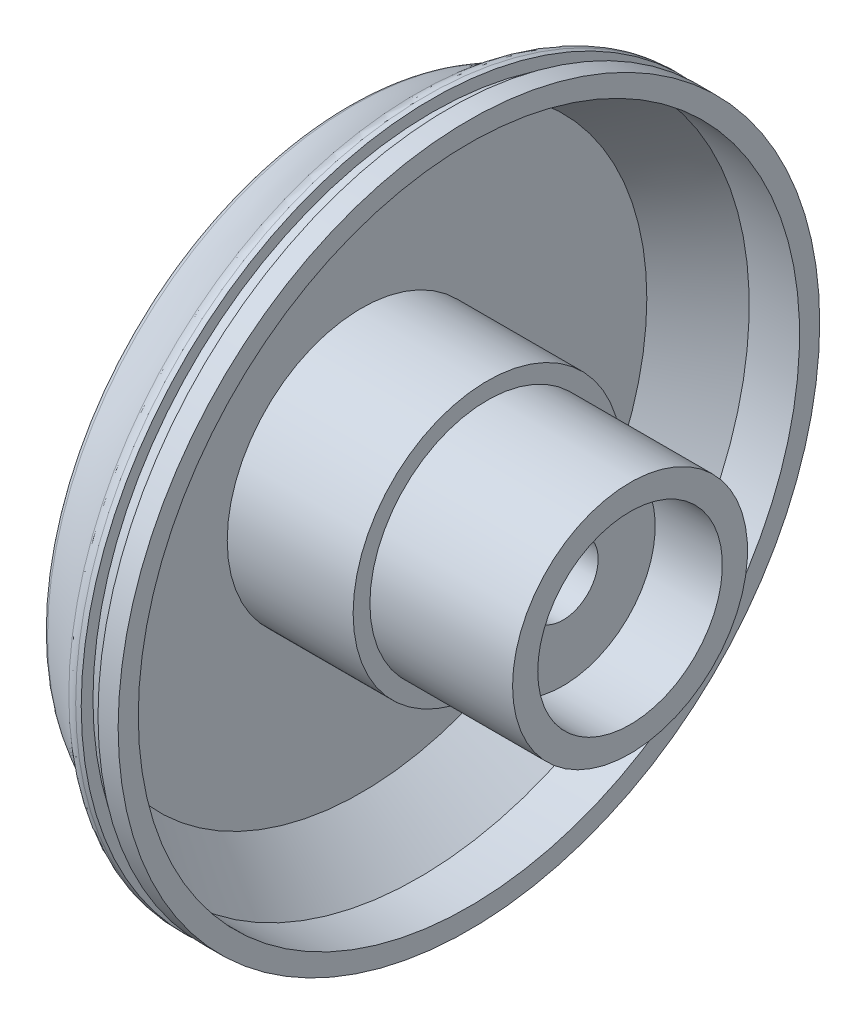
from build123d import *

# Parameters (mm, degrees)
FILLET1_R = 10


with BuildPart() as part:
    # Sketch1 → Revolve1 (revolve)
    with BuildSketch(Plane.XY, mode=Mode.PRIVATE) as revolve1_sk:
        with BuildLine():
            Line((170, 55), (130, 55))
            Line((130, 55), (130, 21.009993912))
            Line((130, 21.009993912), (40, 21.009993912))
            Line((40, 21.009993912), (40, 55))
            Line((40, 55), (0, 55))
            Line((0, 55), (0, 180))
            ThreePointArc((0, 180), (23.569740978, 192.840057103), (45, 209))
            Line((45, 209), (52, 209))
            Line((52, 209), (52, 202))
            Line((52, 202), (62, 202))
            Line((62, 202), (62, 209))
            Line((62, 209), (74, 209))
            Line((74, 209), (74, 197))
            Line((74, 197), (44, 197))
            Line((44, 197), (10, 170))
            Line((10, 170), (10, 80))
            Line((10, 80), (85, 80))
            Line((85, 80), (85, 70))
            Line((85, 70), (170, 70))
            Line((170, 70), (170, 55))
        make_face()
    revolve(revolve1_sk.sketch.rotate(Axis((0, 0, 0), (1, 0, 0)), 90), axis=Axis((0, 0, 0), (1, 0, 0)))

    # Fillet1
    fillet1_edges = [part.edges().sort_by_distance(p)[0] for p in [
        (0, 0, -180),
        (45, 0, -209),
    ]]
    fillet(fillet1_edges, radius=FILLET1_R)


solid = part.part
